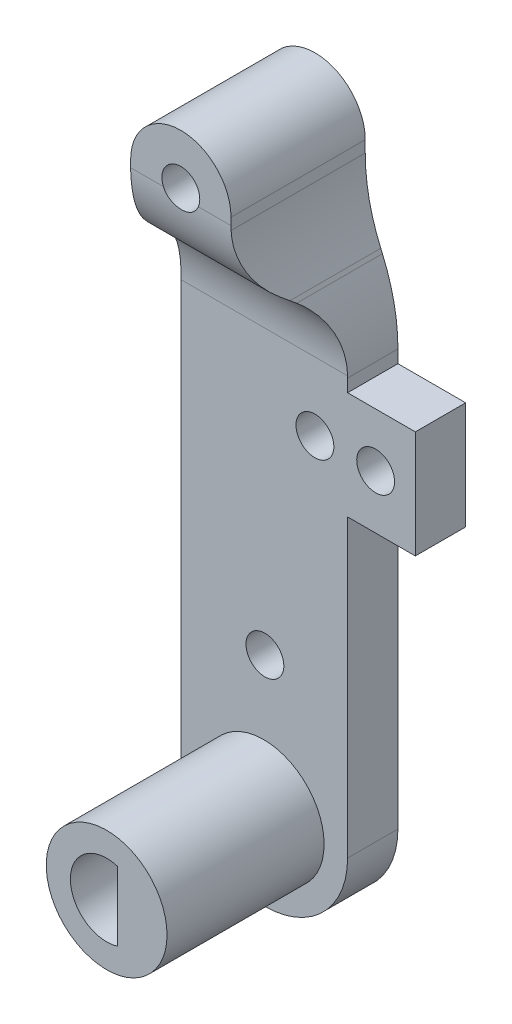
from build123d import *

# Parameters (mm, degrees)
SKETCH1_R           = 1.7907
BOSS_EXTRUDE1_DEPTH = 12.7
CUT_EXTRUDE1_DEPTH  = 43.908371508
SKETCH6_R           = 5.715
BOSS_EXTRUDE2_DEPTH = 14.859


with BuildPart() as part:
    # Sketch1 → Boss-Extrude1 (new body)
    with BuildSketch(Plane.XY):
        with BuildLine():
            ThreePointArc((-5.89797239, 28.334249775), (-10.644578231, 33.080855616), (-15.391184073, 28.334249775))
            Line((-15.391184073, 28.334249775), (-15.391184073, 27.2867057))
            ThreePointArc((-15.391184073, 27.2867057), (-15.767187067, 23.64949685), (-16.879292984, 20.16612393))
            Line((-16.879292984, 20.16612393), (-17.078075162, 19.711310306))
            ThreePointArc((-17.078075162, 19.711310306), (-18.190181079, 16.227937386), (-18.566184073, 12.590728536))
            Line((-18.566184073, 12.590728536), (-18.566184073, -26.593250225))
            ThreePointArc((-18.566184073, -26.593250225), (-10.68587239, -34.473561908), (-2.805560707, -26.593250225))
            Line((-2.805560707, -26.593250225), (-2.805560707, 1.359449775))
            Line((-2.805560707, 1.359449775), (3.60162761, 1.359449775))
            Line((3.60162761, 1.359449775), (3.60162761, 11.531317118))
            Line((3.60162761, 11.531317118), (-2.805560707, 11.531317118))
            Line((-2.805560707, 11.531317118), (-2.805560707, 12.738028185))
            ThreePointArc((-2.805560707, 12.738028185), (-3.176236758, 16.349653807), (-4.272809259, 19.810689652))
            Line((-4.272809259, 19.810689652), (-4.430723837, 20.174911983))
            ThreePointArc((-4.430723837, 20.174911983), (-5.527296339, 23.635947828), (-5.89797239, 27.24757345))
            Line((-5.89797239, 27.24757345), (-5.89797239, 28.334249775))
        make_face()
        with Locations((-10.644578231, 28.334249775)):
            Circle(SKETCH1_R, mode=Mode.SUBTRACT)
        with Locations((-0.151184073, 6.451317118)):
            Circle(SKETCH1_R, mode=Mode.SUBTRACT)
        with Locations((-10.628684073, -13.868682882)):
            Circle(SKETCH1_R, mode=Mode.SUBTRACT)
        with Locations((-5.89797239, 6.451317118)):
            Circle(SKETCH1_R, mode=Mode.SUBTRACT)
    extrude(amount=BOSS_EXTRUDE1_DEPTH)

    # Sketch5 → Cut-Extrude1 (cut, through all)
    with BuildSketch(Plane.ZY.offset(18.566184073)):
        with BuildLine():
            Line((4.7625, -34.473561908), (12.7, -34.473561908))
            Line((12.7, -34.473561908), (12.7, 27.644937325))
            ThreePointArc((12.7, 27.644937325), (11.790590228, 23.757613113), (9.251115022, 20.677129167))
            Line((9.251115022, 20.677129167), (8.211384978, 19.88416172))
            ThreePointArc((8.211384978, 19.88416172), (5.671909772, 16.803677773), (4.7625, 12.916353561))
            Line((4.7625, 12.916353561), (4.7625, -34.473561908))
        make_face()
    extrude(amount=-CUT_EXTRUDE1_DEPTH, mode=Mode.SUBTRACT)

    # Sketch6 → Boss-Extrude2 (add)
    with BuildSketch(Plane.XY.offset(4.7625)):
        with Locations((-10.743060707, -26.568682882)):
            Circle(SKETCH6_R)
        with BuildLine():
            Line((-9.727060707, -23.293658454), (-9.727060707, -29.843707309))
            ThreePointArc((-9.727060707, -29.843707309), (-14.172060707, -26.568682882), (-9.727060707, -23.293658454))
        make_face(mode=Mode.SUBTRACT)
    extrude(amount=BOSS_EXTRUDE2_DEPTH)


solid = part.part
